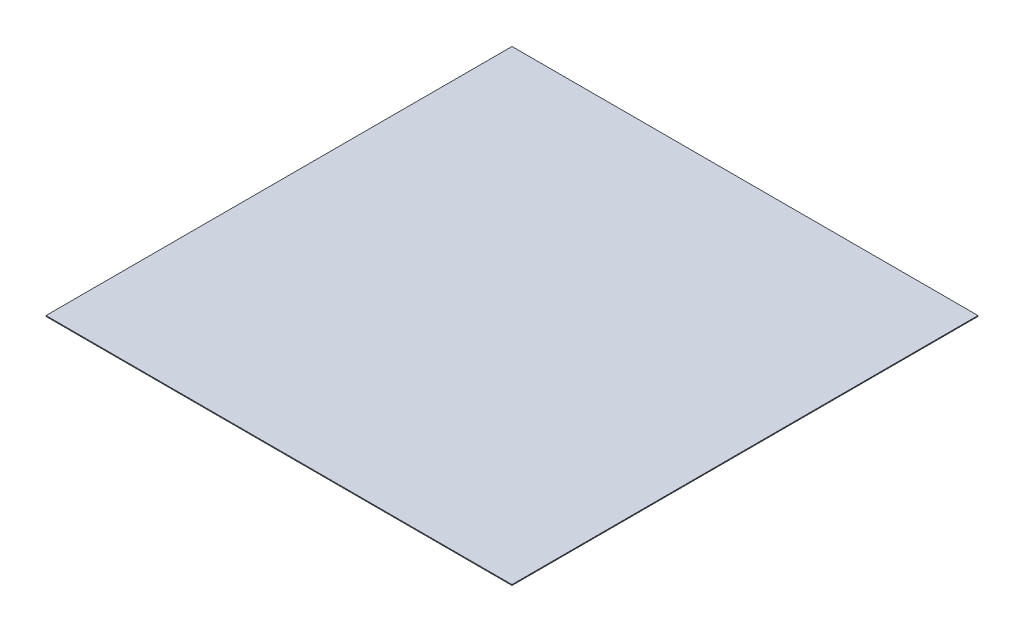
from build123d import *

# Parameters (mm, degrees)
SKETCH1_W           = 140
SKETCH1_H           = 140
BOSS_EXTRUDE1_DEPTH = 0.125


with BuildPart() as part:
    # Sketch1 → Boss-Extrude1 (new, symmetric)
    with BuildSketch(Plane(origin=(0, 0, 0), x_dir=(1, 0, 0), z_dir=(0, 1, 0))):
        Rectangle(SKETCH1_W, SKETCH1_H)
    extrude(amount=BOSS_EXTRUDE1_DEPTH, both=True)


solid = part.part
